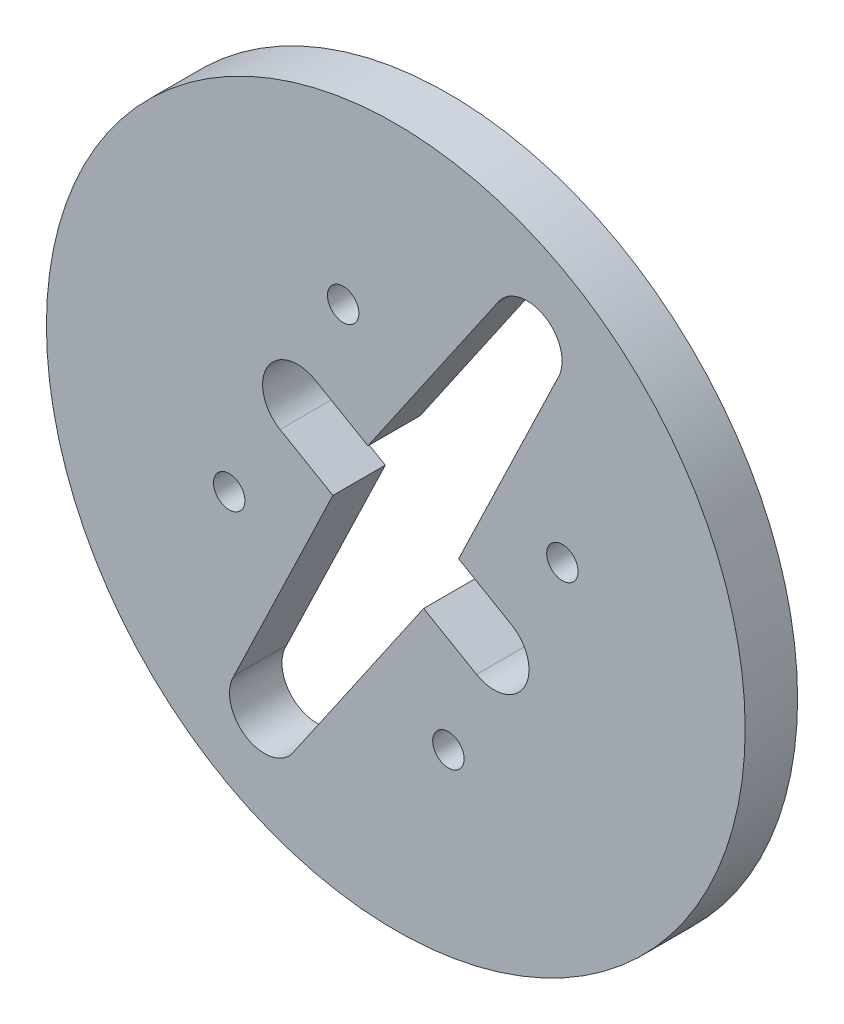
from build123d import *

# Parameters (mm, degrees)
SKETCH1_R           = 20
BOSS_EXTRUDE1_DEPTH = 3
SKETCH2_R           = 0.9
CUT_EXTRUDE1_DEPTH  = 3


with BuildPart() as part:
    # Sketch1 → Boss-Extrude1 (new body)
    with BuildSketch(Plane.XY):
        Circle(SKETCH1_R)
        with BuildLine():
            ThreePointArc((-6.627007241, 1.527342474), (-7.35518547, 4.260427995), (-4.622099949, 4.988606224))
            Line((-4.622099949, 4.988606224), (-1.593494167, 3.234312344))
            Line((-1.593494167, 3.234312344), (5.787770469, 13.982192711))
            ThreePointArc((5.787770469, 13.982192711), (8.037409208, 14.911223436), (9.518402344, 12.979739065))
            ThreePointArc((9.518402344, 12.979739065), (9.449886715, 12.460732201), (9.24903422, 11.977285419))
            Line((9.24903422, 11.977285419), (3.598401459, 0.226951406))
            Line((3.598401459, 0.226951406), (6.627007241, -1.527342474))
            ThreePointArc((6.627007241, -1.527342474), (7.35518547, -4.260427995), (4.622099949, -4.988606224))
            Line((4.622099949, -4.988606224), (1.593494167, -3.234312344))
            Line((1.593494167, -3.234312344), (-5.787770469, -13.982192711))
            ThreePointArc((-5.787770469, -13.982192711), (-8.52085599, -14.71037094), (-9.24903422, -11.977285419))
            Line((-9.24903422, -11.977285419), (-3.598401459, -0.226951406))
            Line((-3.598401459, -0.226951406), (-6.627007241, 1.527342474))
        make_face(mode=Mode.SUBTRACT)
    extrude(amount=BOSS_EXTRUDE1_DEPTH)

    # Sketch2 → Cut-Extrude1 (cut)
    with BuildSketch(Plane(origin=(0, 0, 0), x_dir=(-1, 0, 0), z_dir=(0, 0, -1))):
        with Locations((-3.011222811, -9.535855346)):
            Circle(SKETCH2_R)
        with Locations((-9.535855346, 3.011222811)):
            Circle(SKETCH2_R)
        with Locations((3.011222811, 9.535855346)):
            Circle(SKETCH2_R)
        with Locations((9.535855346, -3.011222811)):
            Circle(SKETCH2_R)
    extrude(amount=-CUT_EXTRUDE1_DEPTH, mode=Mode.SUBTRACT)


solid = part.part
